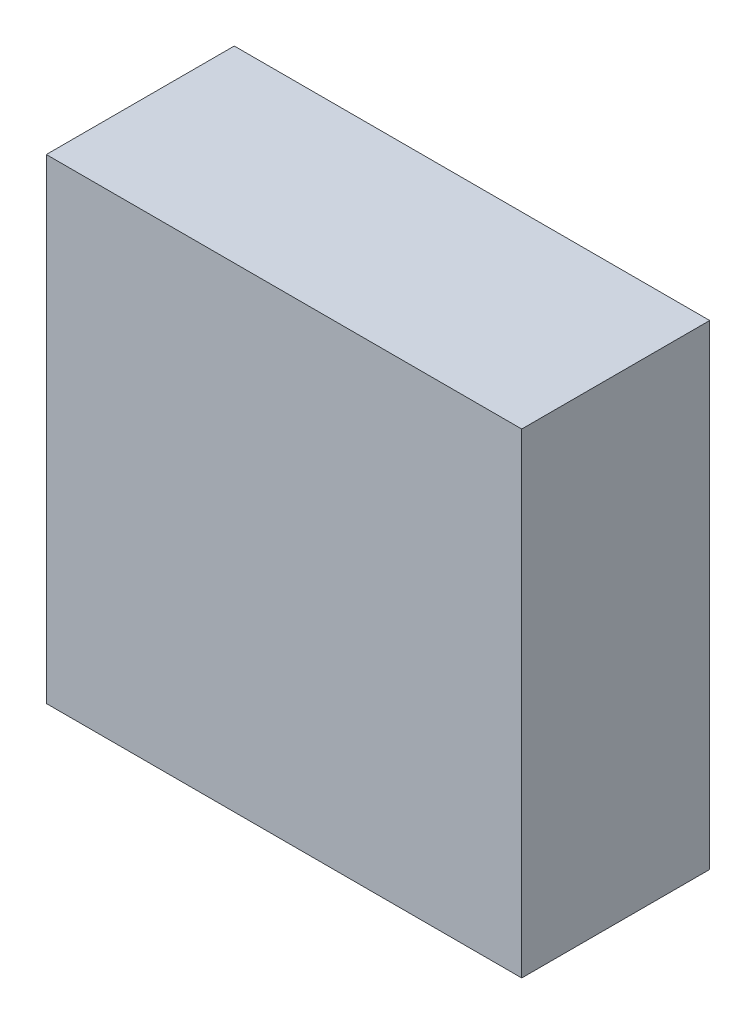
from build123d import *

# Parameters (mm, degrees)
ESBO_O1_W                = 43
ESBO_O1_H                = 43
RESSALTO_EXTRUS_O1_DEPTH = 17


with BuildPart() as part:
    # Esboço1 → Ressalto-extrusão1 (new body)
    with BuildSketch(Plane.XY):
        Rectangle(ESBO_O1_W, ESBO_O1_H)
    extrude(amount=-RESSALTO_EXTRUS_O1_DEPTH)


solid = part.part
